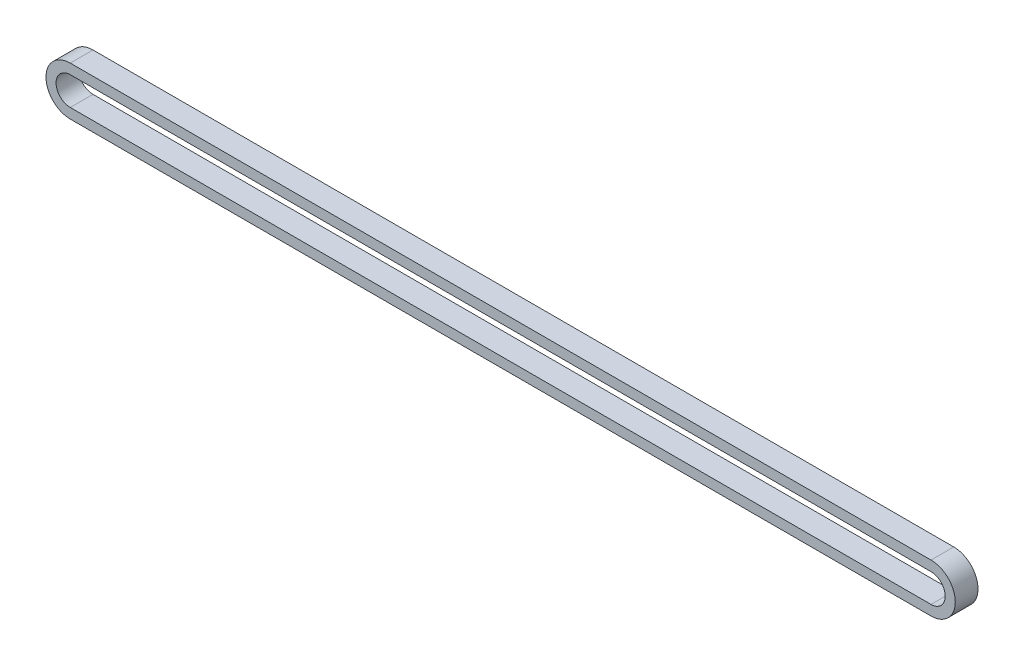
from build123d import *

# Parameters (mm, degrees)
BOSS_EXTRUDE1_DEPTH = 3


with BuildPart() as part:
    # Sketch1 → Boss-Extrude1 (new body)
    with BuildSketch(Plane.XY):
        with BuildLine():
            Line((0, 3.2), (113.6, 3.2))
            ThreePointArc((113.6, 3.2), (116.8, 0), (113.6, -3.2))
            Line((113.6, -3.2), (0, -3.2))
            ThreePointArc((0, -3.2), (-3.2, 0), (0, 3.2))
        make_face()
        with BuildLine():
            Line((0, 1.872), (113.6, 1.872))
            ThreePointArc((113.6, 1.872), (115.472, 0), (113.6, -1.872))
            Line((113.6, -1.872), (0, -1.872))
            ThreePointArc((0, -1.872), (-1.872, 0), (0, 1.872))
        make_face(mode=Mode.SUBTRACT)
    extrude(amount=BOSS_EXTRUDE1_DEPTH)


solid = part.part
